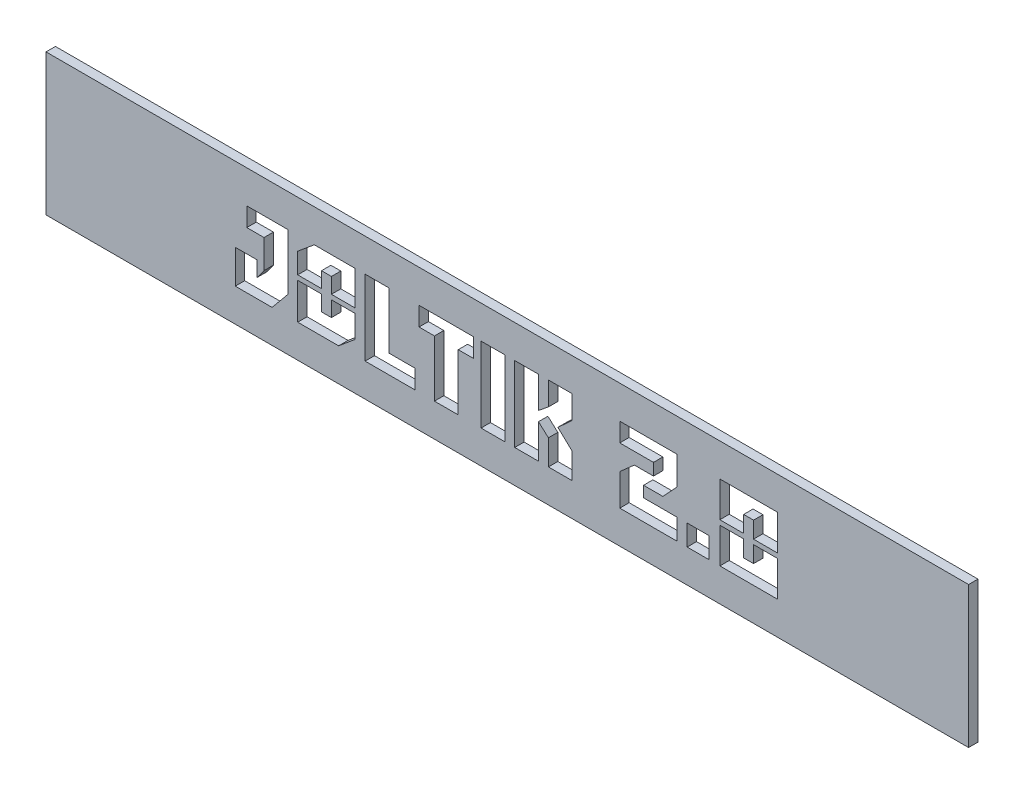
from build123d import *

# Parameters (mm, degrees)
SKETCH1_W           = 98
SKETCH1_H           = 15
BOSS_EXTRUDE1_DEPTH = 1
SKETCH2_W           = 1.052631579
SKETCH2_H           = 3.789473684
SKETCH2_W_2         = 2.526315789
SKETCH2_H_2         = 8
SKETCH2_W_3         = 2.315789474
SKETCH2_H_3         = 2.210526316
SKETCH2_W_4         = 6.105263158
SKETCH2_H_4         = 4
CUT_EXTRUDE1_DEPTH  = 10
SKETCH3_W           = 2.52631579
SKETCH3_H           = 0.5
SKETCH3_W_2         = 2.526315789
BOSS_EXTRUDE2_DEPTH = 1


with BuildPart() as part:
    # Sketch1 → Boss-Extrude1 (new body)
    with BuildSketch(Plane.XY):
        with Locations((0, 8.339183832)):
            Rectangle(SKETCH1_W, SKETCH1_H)
    extrude(amount=BOSS_EXTRUDE1_DEPTH)

    # Sketch2 → Cut-Extrude1 (cut)
    # profile 1 of 9: a face of its own
    with BuildSketch(Plane.XY.offset(1)):
        Polygon((-28.894736842, 4.339183832), (-28.894736842, 7.9181312), (-26.578947368, 7.9181312), (-26.578947368, 6.2931312), (-25.842105263, 7.2931312), (-25.842105263, 10.339183832), (-27.672697368, 10.339183832), (-27.672697368, 12.339183832), (-23.315789474, 12.339183832), (-23.315789474, 6.362210148), (-24.986842105, 4.339183832), align=None)
    # profile 2 of 9: a face of its own
    with BuildSketch(Plane.XY.offset(1)):
        Polygon((-22.263157895, 4.339183832), (-22.263157895, 10.870433832), (-20.503289474, 12.339183832), (-16.157894737, 12.339183832), (-16.157894737, 5.807933832), (-17.917763158, 4.339183832), align=None)
        with Locations((-19.210526316, 8.44444699)):
            Rectangle(SKETCH2_W, SKETCH2_H, mode=Mode.SUBTRACT)
    # profile 3 of 9: a face of its own
    with BuildSketch(Plane.XY.offset(1)):
        Polygon((-15.105263158, 4.339183832), (-15.105263158, 12.339183832), (-12.578947368, 12.339183832), (-12.578947368, 6.339183832), (-9.792763158, 6.339183832), (-9.792763158, 4.339183832), align=None)
    # profile 4 of 9: a face of its own
    with BuildSketch(Plane.XY.offset(1)):
        Polygon((-7.736842105, 4.339183832), (-7.736842105, 10.339183832), (-9.375, 10.339183832), (-9.375, 12.339183832), (-3.572368421, 12.339183832), (-3.572368421, 10.339183832), (-5.210526316, 10.339183832), (-5.210526316, 4.339183832), align=None)
    # profile 5 of 9: a face of its own
    with BuildSketch(Plane.XY.offset(1)):
        with Locations((-1.52631579, 8.339183832)):
            Rectangle(SKETCH2_W_2, SKETCH2_H_2)
    # profile 6 of 9: a face of its own
    with BuildSketch(Plane.XY.offset(1)):
        Polygon((4.368421053, 12.339183832), (6.894736842, 12.339183832), (6.894736842, 9.875368043), (5.371710526, 8.485565411), (6.894736842, 7.039841727), (6.894736842, 4.339183832), (4.368421053, 4.339183832), (4.368421053, 7.021749621), (3.315789474, 7.977341727), (3.315789474, 4.339183832), (0.789473684, 4.339183832), (0.789473684, 12.339183832), (3.315789474, 12.339183832), (3.315789474, 9.00694699), (4.368421053, 9.860565411), align=None)
    # profile 7 of 9: a face of its own
    with BuildSketch(Plane.XY.offset(1)):
        Polygon((18.052631579, 4.339183832), (11.947368421, 4.339183832), (11.947368421, 7.707604885), (13.496710526, 9.076025937), (15.526315789, 9.076025937), (15.526315789, 10.339183832), (11.947368421, 10.339183832), (11.947368421, 12.339183832), (18.052631579, 12.339183832), (18.052631579, 9.3556312), (16.526315789, 7.707604885), (14.473684211, 7.707604885), (14.473684211, 6.549710148), (18.052631579, 6.549710148), align=None)
    # profile 8 of 9: a face of its own
    with BuildSketch(Plane.XY.offset(1)):
        with Locations((20.263157895, 5.44444699)):
            Rectangle(SKETCH2_W_3, SKETCH2_H_3)
    # profile 9 of 9: a face of its own
    with BuildSketch(Plane.XY.offset(1)):
        with Locations((25.631578947, 8.339183832)):
            Rectangle(SKETCH2_W_4, SKETCH2_H_2)
        with Locations((25.631578948, 8.339183832)):
            Rectangle(SKETCH2_W, SKETCH2_H_4, mode=Mode.SUBTRACT)
    extrude(amount=-CUT_EXTRUDE1_DEPTH, mode=Mode.SUBTRACT)


with BuildPart() as cut_extrude1_piece_1:
    # of the separate pieces the step leaves, piece 1, a body of its own (cut_extrude1_pieces)
    add(part.part.solids().sort_by_distance((49, 15.839183832, 0))[0])



with BuildPart() as cut_extrude1_piece_2:
    # of the separate pieces the step leaves, piece 2, a body of its own (cut_extrude1_pieces)
    add(part.part.solids().sort_by_distance((26.157894737, 10.339183832, 0))[0])


with BuildPart() as cut_extrude1_piece_3:
    # of the separate pieces the step leaves, piece 3, a body of its own (cut_extrude1_pieces)
    add(part.part.solids().sort_by_distance((-18.684210526, 10.339183832, 0))[0])


with BuildPart() as cut_extrude1_piece_1_1:
    add(cut_extrude1_piece_1.part)

    add(cut_extrude1_piece_2.part)  # Boss-Extrude2 merges Cut-Extrude1 piece 2

    add(cut_extrude1_piece_3.part)  # Boss-Extrude2 merges Cut-Extrude1 piece 3
    # Sketch3 → Boss-Extrude2 (add)
    with BuildSketch(Plane.XY.offset(1)):
        with Locations((-21, 8.44444699)):
            Rectangle(SKETCH3_W, SKETCH3_H)
        with Locations((-17.421052632, 8.44444699)):
            Rectangle(SKETCH3_W_2, SKETCH3_H)
        with Locations((23.842105263, 8.339183832)):
            Rectangle(SKETCH3_W, SKETCH3_H)
        with Locations((27.421052632, 8.339183832)):
            Rectangle(SKETCH3_W_2, SKETCH3_H)
    extrude(amount=-BOSS_EXTRUDE2_DEPTH)


solid = cut_extrude1_piece_1_1.part
